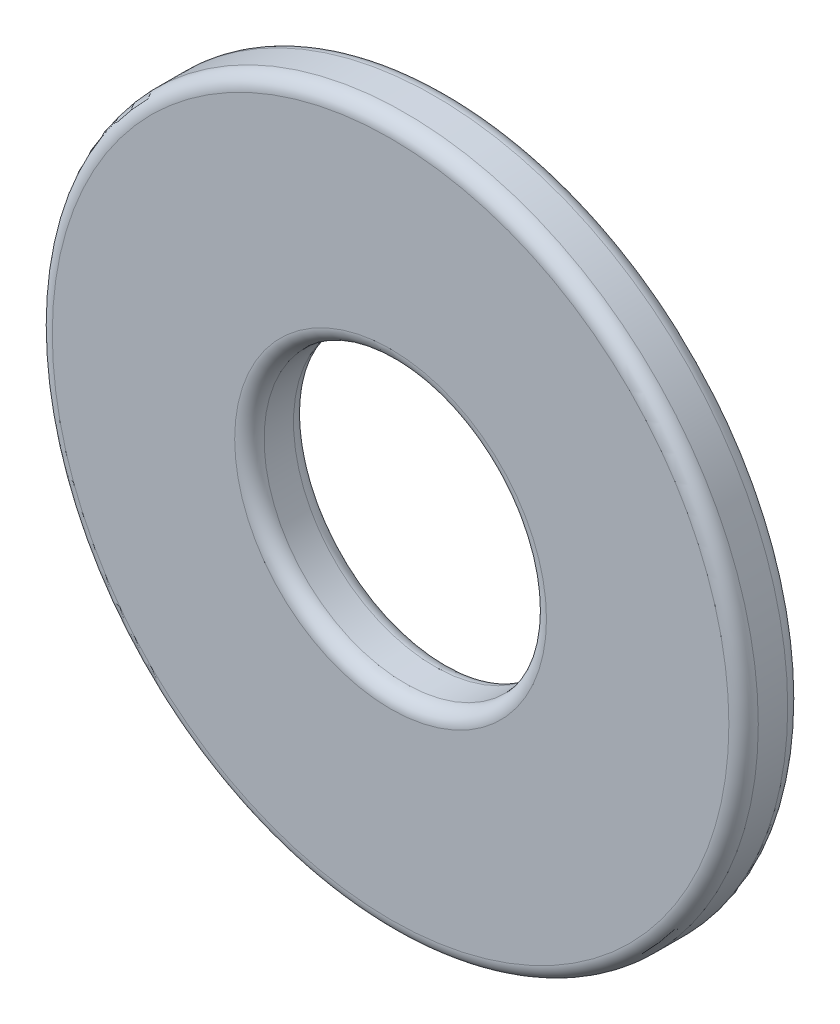
from build123d import *

# Parameters (mm, degrees)
SKETCH1_R           = 9.525
SKETCH1_R_2         = 3.81
BOSS_EXTRUDE1_DEPTH = 1.5875
FILLET1_R           = 0.396875


with BuildPart() as part:
    # Sketch1 → Boss-Extrude1 (new body)
    with BuildSketch(Plane.XY):
        Circle(SKETCH1_R)
        Circle(SKETCH1_R_2, mode=Mode.SUBTRACT)
    extrude(amount=BOSS_EXTRUDE1_DEPTH)

    # Fillet1
    fillet1_edges = [part.edges().sort_by_distance(p)[0] for p in [
        (-9.525, 0, 0),
        (-9.525, 0, 1.5875),
        (-3.81, 0, 0),
        (-3.81, 0, 1.5875),
    ]]
    fillet(fillet1_edges, radius=FILLET1_R)


solid = part.part
